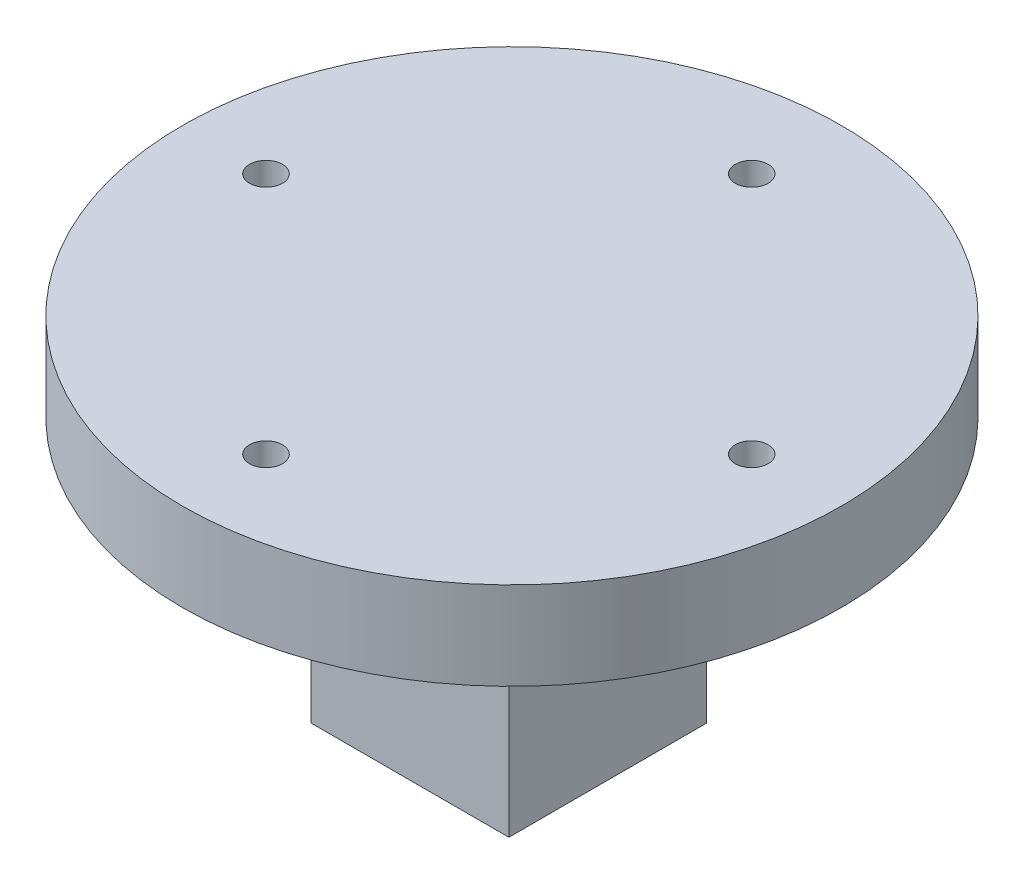
from build123d import *

# Parameters (mm, degrees)
SKETCH1_W           = 18
SKETCH1_H           = 18
BOSS_EXTRUDE1_DEPTH = 24.25
SKETCH2_R           = 30
BOSS_EXTRUDE2_DEPTH = 8
SKETCH3_R           = 1.5
CUT_EXTRUDE1_DEPTH  = 12


with BuildPart() as part:
    # Sketch1 → Boss-Extrude1 (new body)
    with BuildSketch(Plane(origin=(0, 0, 0), x_dir=(1, 0, 0), z_dir=(0, 1, 0))):
        Rectangle(SKETCH1_W, SKETCH1_H)
    extrude(amount=BOSS_EXTRUDE1_DEPTH)

    # Sketch2 → Boss-Extrude2 (add)
    with BuildSketch(Plane(origin=(0, 24.25, 0), x_dir=(1, 0, 0), z_dir=(0, 1, 0))):
        with Locations(Location((0.279992144, 0, 0), (0, 0, 270))):
            Circle(SKETCH2_R)
    extrude(amount=BOSS_EXTRUDE2_DEPTH)

    # Sketch3 → Cut-Extrude1 (cut)
    with BuildSketch(Plane(origin=(0, 32.25, 0), x_dir=(1, 0, 0), z_dir=(0, 1, 0))):
        with Locations(Location((0, 22.106714755, 0), (0, 0, 270))):
            Circle(SKETCH3_R)
        with Locations(Location((22.106714755, 0, 0), (0, 0, 270))):
            Circle(SKETCH3_R)
        with Locations(Location((0, -22.106714755, 0), (0, 0, 270))):
            Circle(SKETCH3_R)
        with Locations(Location((-22.106714755, 0, 0), (0, 0, 270))):
            Circle(SKETCH3_R)
    extrude(amount=-CUT_EXTRUDE1_DEPTH, mode=Mode.SUBTRACT)


solid = part.part
